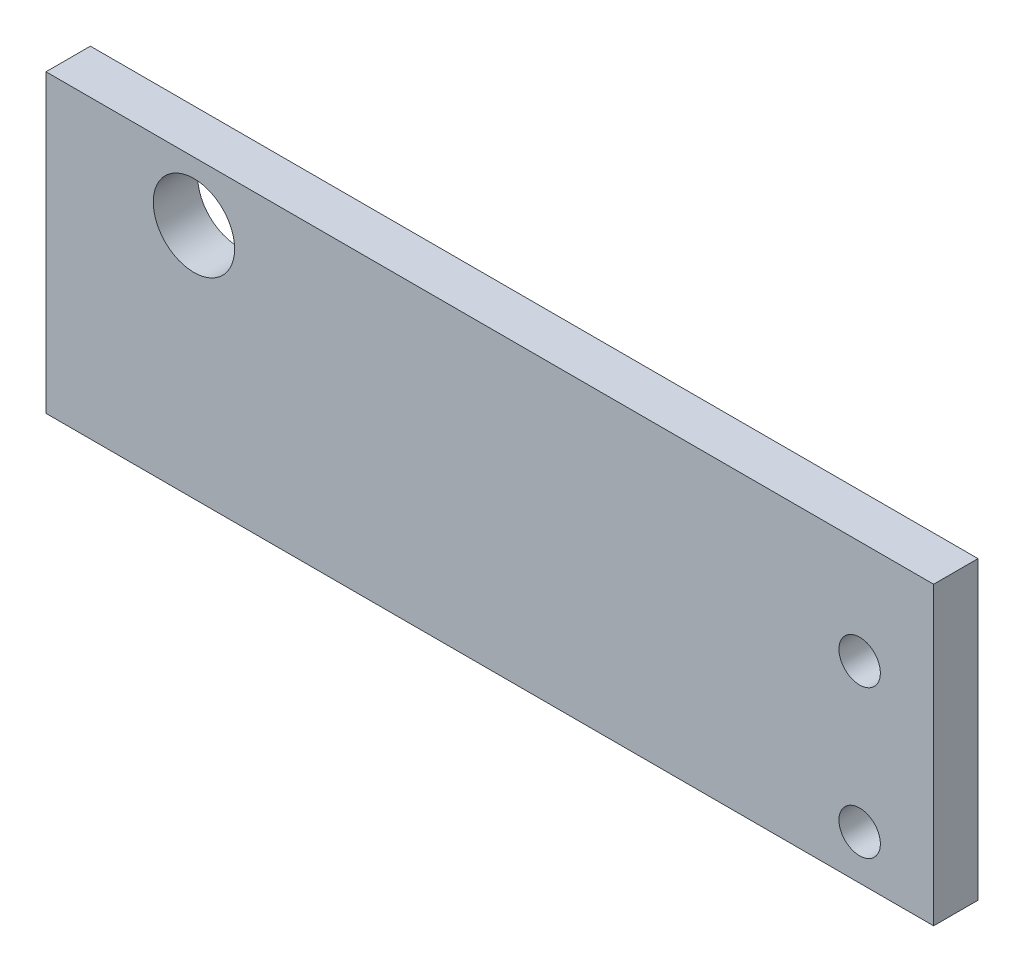
from build123d import *

# Parameters (mm, degrees)
SKETCH1_W           = 60
SKETCH1_H           = 20
SKETCH1_R           = 2.75
SKETCH1_R_2         = 1.4
BOSS_EXTRUDE1_DEPTH = 3


with BuildPart() as part:
    # Sketch1 → Boss-Extrude1 (new body)
    with BuildSketch(Plane.XY):
        with Locations((5.64516129, 5.967741935)):
            Rectangle(SKETCH1_W, SKETCH1_H)
        with Locations((-14.35483871, 11.967741935)):
            Circle(SKETCH1_R, mode=Mode.SUBTRACT)
        with Locations((30.64516129, 8.967741935)):
            Circle(SKETCH1_R_2, mode=Mode.SUBTRACT)
        with Locations((30.64516129, -1.032258065)):
            Circle(SKETCH1_R_2, mode=Mode.SUBTRACT)
    extrude(amount=BOSS_EXTRUDE1_DEPTH)


solid = part.part
